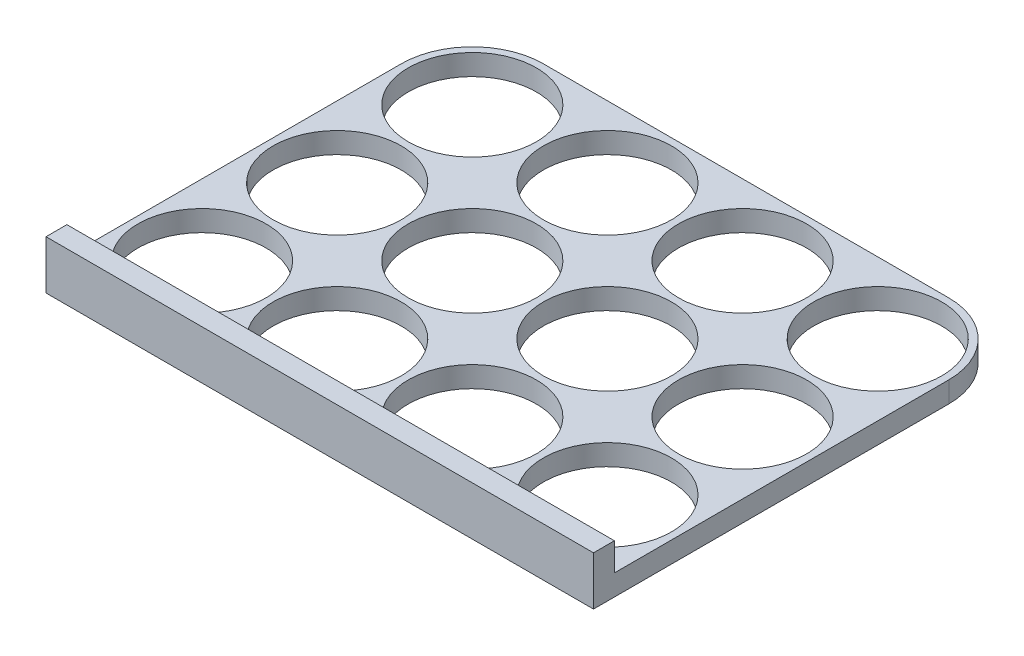
from build123d import *

# Parameters (mm, degrees)
SKETCH1_R           = 9.2
BOSS_EXTRUDE1_DEPTH = 3
SKETCH2_W           = 78.6
SKETCH2_H           = 3
BOSS_EXTRUDE2_DEPTH = 4


with BuildPart() as part:
    # Sketch1 → Boss-Extrude1 (new body)
    with BuildSketch(Plane(origin=(0, 0, 0), x_dir=(1, 0, 0), z_dir=(0, 1, 0))):
        with BuildLine():
            Line((0, 49), (58.2, 49))
            ThreePointArc((58.2, 49), (65.412489168, 46.012489168), (68.4, 38.8))
            Line((68.4, 38.8), (68.4, 0))
            Line((68.4, 0), (68.4, -12.2))
            Line((68.4, -12.2), (-10.2, -12.2))
            Line((-10.2, -12.2), (-10.2, 0))
            Line((-10.2, 0), (-10.2, 38.8))
            ThreePointArc((-10.2, 38.8), (-7.212489168, 46.012489168), (0, 49))
        make_face()
        with Locations(Location((0, 0, 0), (0, 0, 270))):
            Circle(SKETCH1_R, mode=Mode.SUBTRACT)
        with Locations(Location((19.4, 0, 0), (0, 0, 270))):
            Circle(SKETCH1_R, mode=Mode.SUBTRACT)
        with Locations(Location((38.8, 0, 0), (0, 0, 270))):
            Circle(SKETCH1_R, mode=Mode.SUBTRACT)
        with Locations(Location((58.2, 0, 0), (0, 0, 270))):
            Circle(SKETCH1_R, mode=Mode.SUBTRACT)
        with Locations(Location((19.4, 19.4, 0), (0, 0, 270))):
            Circle(SKETCH1_R, mode=Mode.SUBTRACT)
        with Locations(Location((38.8, 19.4, 0), (0, 0, 270))):
            Circle(SKETCH1_R, mode=Mode.SUBTRACT)
        with Locations(Location((58.2, 19.4, 0), (0, 0, 270))):
            Circle(SKETCH1_R, mode=Mode.SUBTRACT)
        with Locations(Location((19.4, 38.8, 0), (0, 0, 270))):
            Circle(SKETCH1_R, mode=Mode.SUBTRACT)
        with Locations(Location((38.8, 38.8, 0), (0, 0, 270))):
            Circle(SKETCH1_R, mode=Mode.SUBTRACT)
        with Locations(Location((58.2, 38.8, 0), (0, 0, 270))):
            Circle(SKETCH1_R, mode=Mode.SUBTRACT)
        with Locations(Location((0, 19.4, 0), (0, 0, 270))):
            Circle(SKETCH1_R, mode=Mode.SUBTRACT)
        with Locations(Location((0, 38.8, 0), (0, 0, 270))):
            Circle(SKETCH1_R, mode=Mode.SUBTRACT)
    extrude(amount=BOSS_EXTRUDE1_DEPTH)

    # Sketch2 → Boss-Extrude2 (add)
    with BuildSketch(Plane(origin=(0, 3, 0), x_dir=(1, 0, 0), z_dir=(0, 1, 0))):
        with Locations((29.1, -10.7)):
            Rectangle(SKETCH2_W, SKETCH2_H)
    extrude(amount=BOSS_EXTRUDE2_DEPTH)


solid = part.part
